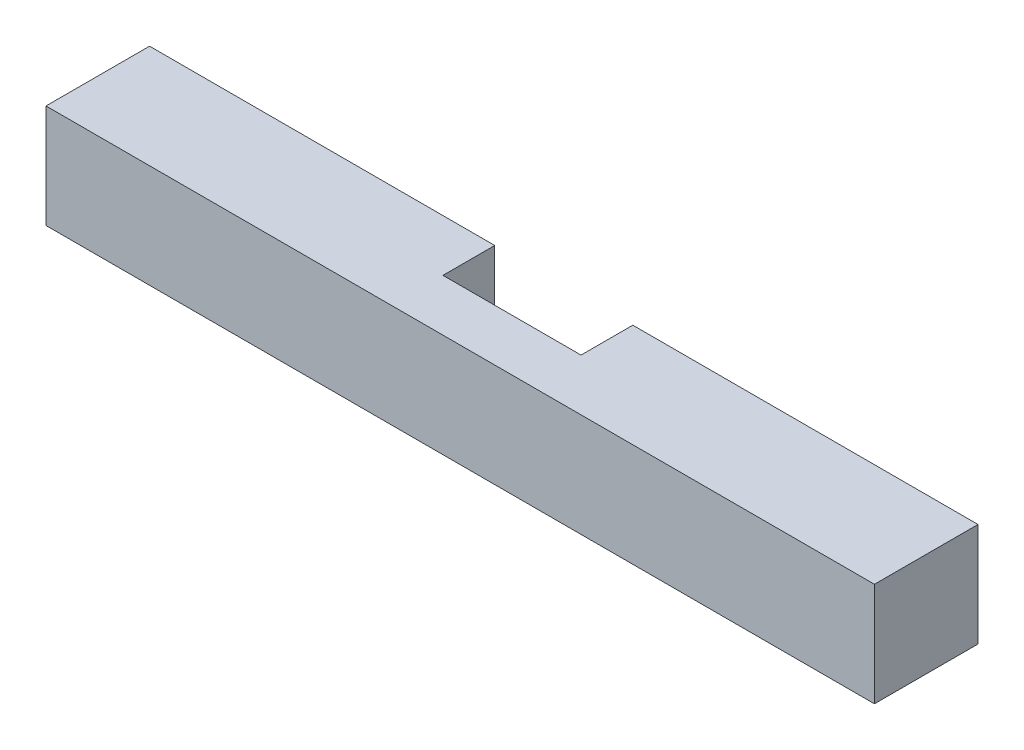
from build123d import *

# Parameters (mm, degrees)
BOSS_EXTRUDE1_DEPTH = 6.35


with BuildPart() as part:
    # Sketch1 → Boss-Extrude1 (new body)
    with BuildSketch(Plane(origin=(0, 0, 0), x_dir=(1, 0, 0), z_dir=(0, 1, 0))):
        Polygon((0, 0), (50.8, 0), (50.8, 6.35), (29.633333333, 6.35), (29.633333333, 3.175), (21.166666667, 3.175), (21.166666667, 6.35), (0, 6.35), align=None)
    extrude(amount=BOSS_EXTRUDE1_DEPTH)


solid = part.part
